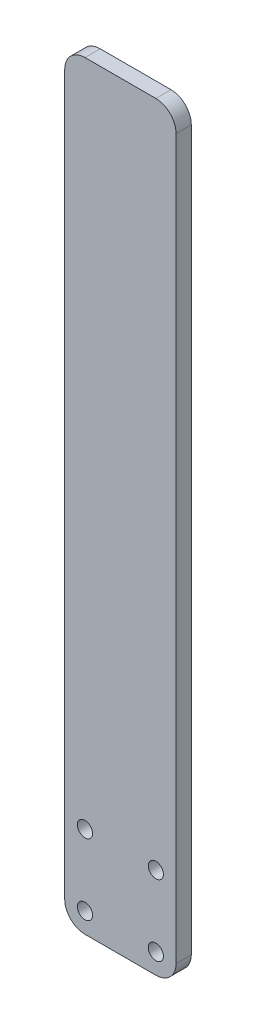
from build123d import *

# Parameters (mm, degrees)
ESQUISSE1_W        = 22
ESQUISSE1_H        = 150
ESQUISSE1_R        = 1.5
BOSS_EXTRU_1_DEPTH = 3
CONG_1_R           = 4


with BuildPart() as part:
    # Esquisse1 → Boss.-Extru.1 (new body)
    with BuildSketch(Plane.XY):
        with Locations((0, 75)):
            Rectangle(ESQUISSE1_W, ESQUISSE1_H)
        with Locations((7, 4)):
            Circle(ESQUISSE1_R, mode=Mode.SUBTRACT)
        with Locations(Location((-7, 4, 0), (0, 0, 180))):
            Circle(ESQUISSE1_R, mode=Mode.SUBTRACT)
        with Locations(Location((7, 18, 0), (0, 0, 180))):
            Circle(ESQUISSE1_R, mode=Mode.SUBTRACT)
        with Locations((-7, 18)):
            Circle(ESQUISSE1_R, mode=Mode.SUBTRACT)
    extrude(amount=BOSS_EXTRU_1_DEPTH)

    # Congé1
    cong_1_edges = [part.edges().sort_by_distance(p)[0] for p in [
        (-11, 150, 1.5),
        (11, 150, 1.5),
        (11, 0, 1.5),
        (-11, 0, 1.5),
    ]]
    fillet(cong_1_edges, radius=CONG_1_R)


solid = part.part
